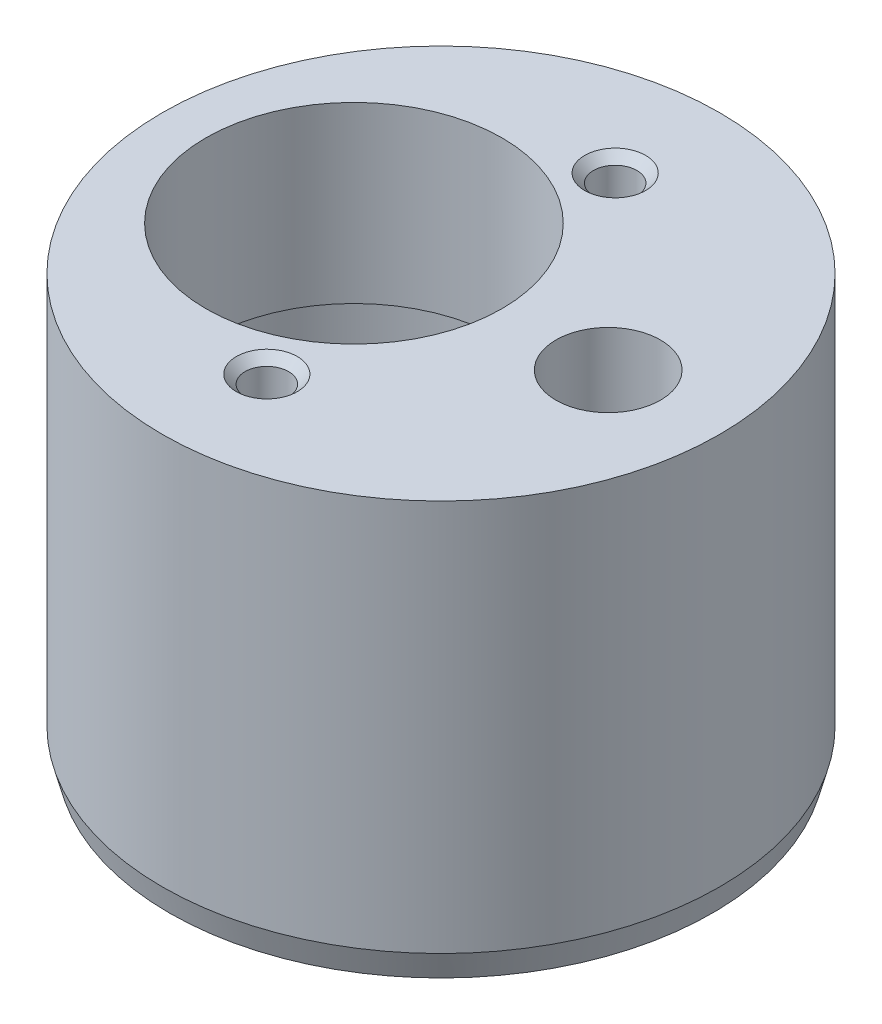
from build123d import *

# Parameters (mm, degrees)
SKETCH_1_R          = 16
EXTRUDE_1_DEPTH     = 24
SKETCH_2_R          = 8.5
CUT_EXTRUDE_1_DEPTH = 14
SKETCH_3_R          = 3
CUT_EXTRUDE_2_DEPTH = 20
SKETCH_4_R          = 9.5
CUT_EXTRUDE_4_DEPTH = 14
CHAMFER_1_SIZE      = 0.5
CHAMFER_1_SIZE2     = 0.866025404
CHAMFER_2_SIZE      = 1.5
CHAMFER_2_SIZE2     = 0.401923789
M3X0_51_D           = 2.5
M3X0_51_DEPTH       = 5.5
M3X0_51_TIP         = 0.751075774
CHAMFER_3_SIZE      = 0.5


with BuildPart() as part:
    # Эскиз1 → Бобышка-Вытянуть1 (new body)
    with BuildSketch(Plane(origin=(0, 0, 0), x_dir=(1, 0, 0), z_dir=(0, 1, 0))):
        with Locations(Location((0, 0, 0), (0, 0, 270))):
            Circle(SKETCH_1_R)
    extrude(amount=EXTRUDE_1_DEPTH)

    # Эскиз2 → Вырез-Вытянуть1 (cut)
    with BuildSketch(Plane(origin=(0, 24, 0), x_dir=(1, 0, 0), z_dir=(0, 1, 0))):
        with Locations(Location((-5, 0, 0), (0, 0, 270))):
            Circle(SKETCH_2_R)
    extrude(amount=-CUT_EXTRUDE_1_DEPTH, mode=Mode.SUBTRACT)

    # Эскиз3 → Вырез-Вытянуть2 (cut)
    with BuildSketch(Plane(origin=(0, 24, 0), x_dir=(1, 0, 0), z_dir=(0, 1, 0))):
        with Locations(Location((9.6, 0, 0), (0, 0, 270))):
            Circle(SKETCH_3_R)
    extrude(amount=-CUT_EXTRUDE_2_DEPTH, mode=Mode.SUBTRACT)

    # Эскиз4 → Вырез-Вытянуть4 (cut)
    with BuildSketch(Plane(origin=(0, 0, 0), x_dir=(1, 0, 0), z_dir=(0, 1, 0))):
        with Locations(Location((-5, 0, 0), (0, 0, 270))):
            Circle(SKETCH_4_R)
    extrude(amount=CUT_EXTRUDE_4_DEPTH, mode=Mode.SUBTRACT)

    # Фаска1
    chamfer_1_edges = [part.edges().sort_by_distance(p)[0] for p in [
        (-5, 0, -9.5),
    ]]
    chamfer_1_side = [part.faces().sort_by_distance(p)[0] for p in [
        (0, 0, -15.54745166),
    ]]
    chamfer(chamfer_1_edges, length=CHAMFER_1_SIZE, length2=CHAMFER_1_SIZE2, reference=chamfer_1_side[0])

    # Фаска2
    chamfer_2_edges = [part.edges().sort_by_distance(p)[0] for p in [
        (0, 0, -16),
    ]]
    chamfer_2_side = [part.faces().sort_by_distance(p)[0] for p in [
        (0, 12, -16),
    ]]
    chamfer(chamfer_2_edges, length=CHAMFER_2_SIZE, length2=CHAMFER_2_SIZE2, reference=chamfer_2_side[0])

    # Отверстие обработанное метчиком M3x0.51
    with Locations(Plane(origin=(0, 24, 0), x_dir=(1, 0, 0), z_dir=(0, 1, 0))):
        with Locations((0, 10), (0, -10)):
            Hole(M3X0_51_D / 2, depth=M3X0_51_DEPTH)
            with Locations((0, 0, -(M3X0_51_DEPTH + M3X0_51_TIP / 2))):  # 118° drill point
                Cone(0, M3X0_51_D / 2, M3X0_51_TIP, mode=Mode.SUBTRACT)

    # Фаска3
    chamfer_3_edges = [part.edges().sort_by_distance(p)[0] for p in [
        (1.25, 24, 10),
        (1.25, 24, -10),
    ]]
    chamfer(chamfer_3_edges, length=CHAMFER_3_SIZE)


solid = part.part
